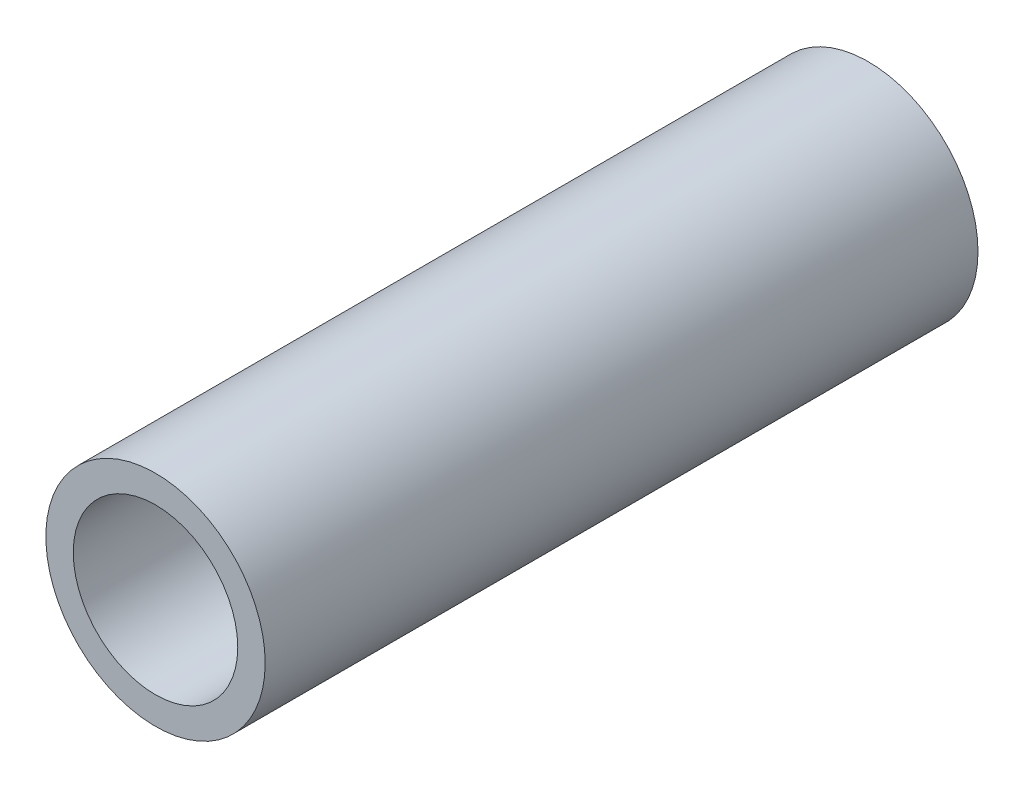
from build123d import *

# Parameters (mm, degrees)
SKETCH1_R           = 20
BOSS_EXTRUDE1_DEPTH = 130
SKETCH2_R           = 15
CUT_EXTRUDE1_DEPTH  = 130


with BuildPart() as part:
    # Sketch1 → Boss-Extrude1 (new body)
    with BuildSketch(Plane.XY):
        Circle(SKETCH1_R)
    extrude(amount=BOSS_EXTRUDE1_DEPTH)

    # Sketch2 → Cut-Extrude1 (cut)
    with BuildSketch(Plane.XY.offset(130)):
        Circle(SKETCH2_R)
    extrude(amount=-CUT_EXTRUDE1_DEPTH, mode=Mode.SUBTRACT)


solid = part.part
